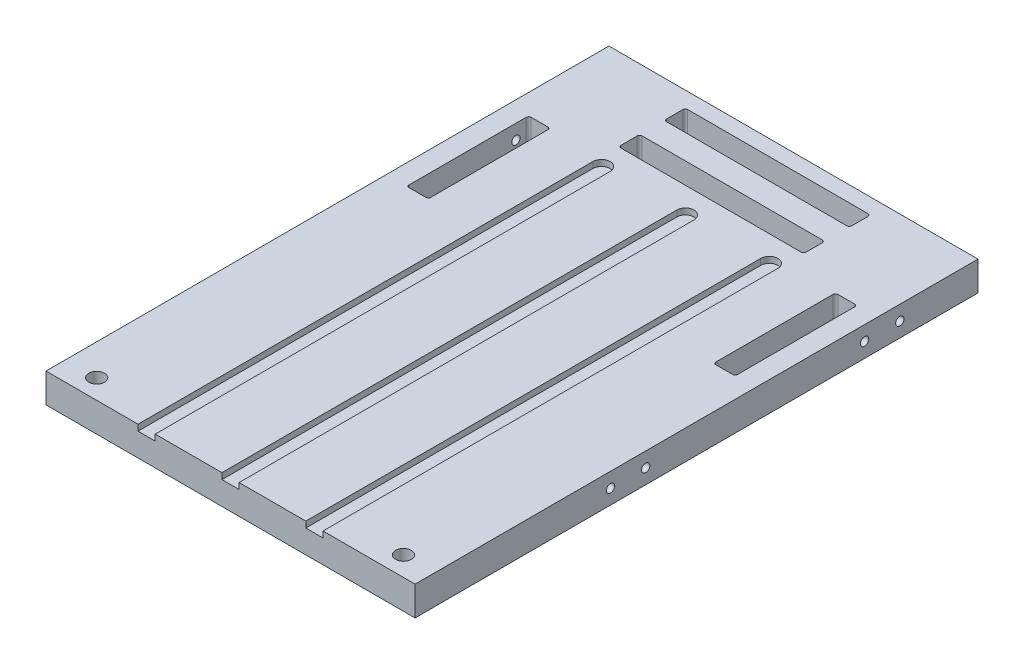
from build123d import *

# Parameters (mm, degrees)
SKETCH1_W                      = 119.888
SKETCH1_H                      = 182.88
BOSS_EXTRUDE1_DEPTH            = 9.525
F_1_4_20_TAPPED_HOLE1_D        = 5.1054
CUT_EXTRUDE1_DEPTH             = 1.9685
CUT_EXTRUDE2_DEPTH             = 1.9685
F_6_32_TAPPED_HOLE1_AT_2_COUNT = 2
F_6_32_TAPPED_HOLE1_AT_2_PITCH = 93.98
F_6_32_TAPPED_HOLE1_AT_3_COUNT = 2
F_6_32_TAPPED_HOLE1_AT_3_PITCH = 82.55
F_6_32_TAPPED_HOLE1_AT_4_COUNT = 2
F_6_32_TAPPED_HOLE1_AT_4_PITCH = 11.43


with BuildPart() as part:
    # Sketch1 → Boss-Extrude1 (new body)
    with BuildSketch(Plane(origin=(0, 0, 0), x_dir=(1, 0, 0), z_dir=(0, 1, 0))):
        Rectangle(SKETCH1_W, SKETCH1_H)
        with BuildLine():
            Line((-29.26715, 79.502), (29.26715, 79.502))
            ThreePointArc((29.26715, 79.502), (29.828416008, 79.734483992), (30.0609, 80.29575))
            Line((30.0609, 80.29575), (30.0609, 85.56625))
            ThreePointArc((30.0609, 85.56625), (29.828416008, 86.127516008), (29.26715, 86.36))
            Line((29.26715, 86.36), (-29.26715, 86.36))
            ThreePointArc((-29.26715, 86.36), (-29.828416008, 86.127516008), (-30.0609, 85.56625))
            Line((-30.0609, 85.56625), (-30.0609, 80.29575))
            ThreePointArc((-30.0609, 80.29575), (-29.828416008, 79.734483992), (-29.26715, 79.502))
        make_face(mode=Mode.SUBTRACT)
        with BuildLine():
            Line((-29.26715, 64.6811), (29.26715, 64.6811))
            ThreePointArc((29.26715, 64.6811), (29.828416008, 64.913583992), (30.0609, 65.47485))
            Line((30.0609, 65.47485), (30.0609, 70.74535))
            ThreePointArc((30.0609, 70.74535), (29.828416008, 71.306616008), (29.26715, 71.5391))
            Line((29.26715, 71.5391), (-29.26715, 71.5391))
            ThreePointArc((-29.26715, 71.5391), (-29.828416008, 71.306616008), (-30.0609, 70.74535))
            Line((-30.0609, 70.74535), (-30.0609, 65.47485))
            ThreePointArc((-30.0609, 65.47485), (-29.828416008, 64.913583992), (-29.26715, 64.6811))
        make_face(mode=Mode.SUBTRACT)
        with BuildLine():
            Line((-52.54625, 19.1262), (-47.11065, 19.1262))
            ThreePointArc((-47.11065, 19.1262), (-46.549383992, 19.358683992), (-46.3169, 19.91995))
            Line((-46.3169, 19.91995), (-46.3169, 57.95645))
            ThreePointArc((-46.3169, 57.95645), (-46.549383992, 58.517716008), (-47.11065, 58.7502))
            Line((-47.11065, 58.7502), (-52.54625, 58.7502))
            ThreePointArc((-52.54625, 58.7502), (-53.107516008, 58.517716008), (-53.34, 57.95645))
            Line((-53.34, 57.95645), (-53.34, 19.91995))
            ThreePointArc((-53.34, 19.91995), (-53.107516008, 19.358683992), (-52.54625, 19.1262))
        make_face(mode=Mode.SUBTRACT)
        with BuildLine():
            Line((46.3169, 19.91995), (46.3169, 57.95645))
            ThreePointArc((46.3169, 57.95645), (46.549383992, 58.517716008), (47.11065, 58.7502))
            Line((47.11065, 58.7502), (52.54625, 58.7502))
            ThreePointArc((52.54625, 58.7502), (53.107516008, 58.517716008), (53.34, 57.95645))
            Line((53.34, 57.95645), (53.34, 19.91995))
            ThreePointArc((53.34, 19.91995), (53.107516008, 19.358683992), (52.54625, 19.1262))
            Line((52.54625, 19.1262), (47.11065, 19.1262))
            ThreePointArc((47.11065, 19.1262), (46.549383992, 19.358683992), (46.3169, 19.91995))
        make_face(mode=Mode.SUBTRACT)
    extrude(amount=BOSS_EXTRUDE1_DEPTH)

    # 1/4-20 Tapped Hole1 (through all)
    with Locations(Plane(origin=(0, 9.525, 0), x_dir=(1, 0, 0), z_dir=(0, 1, 0))):
        with Locations((-49.82845, -85.09), (49.82845, -85.09)):
            Hole(F_1_4_20_TAPPED_HOLE1_D / 2)

    # Sketch4 → Cut-Extrude1 (cut)
    with BuildSketch(Plane(origin=(0, 9.525, 0), x_dir=(1, 0, 0), z_dir=(0, 1, 0))):
        with BuildLine():
            Line((-30.0482, -91.44), (-24.4602, -91.44))
            Line((-24.4602, -91.44), (-24.4602, 56.3372))
            ThreePointArc((-24.4602, 56.3372), (-27.2542, 59.1312), (-30.0482, 56.3372))
            Line((-30.0482, 56.3372), (-30.0482, -91.44))
        make_face()
        with BuildLine():
            Line((-2.794, 56.3372), (-2.794, -91.44))
            Line((-2.794, -91.44), (2.794, -91.44))
            Line((2.794, -91.44), (2.794, 56.3372))
            ThreePointArc((2.794, 56.3372), (0, 59.1312), (-2.794, 56.3372))
        make_face()
        with BuildLine():
            Line((30.0482, 56.3372), (30.0482, -91.44))
            Line((30.0482, -91.44), (24.4602, -91.44))
            Line((24.4602, -91.44), (24.4602, 56.3372))
            ThreePointArc((24.4602, 56.3372), (27.2542, 59.1312), (30.0482, 56.3372))
        make_face()
    extrude(amount=-CUT_EXTRUDE1_DEPTH, mode=Mode.SUBTRACT)

    # Sketch5 → Cut-Extrude2 (cut)
    with BuildSketch(Plane.XZ):
        with BuildLine():
            Line((-40.005, -73.10755), (40.005, -73.10755))
            ThreePointArc((40.005, -73.10755), (42.418, -75.52055), (40.005, -77.93355))
            Line((40.005, -77.93355), (-40.005, -77.93355))
            ThreePointArc((-40.005, -77.93355), (-42.418, -75.52055), (-40.005, -73.10755))
        make_face()
        with BuildLine():
            Line((-40.005, -58.28665), (40.005, -58.28665))
            ThreePointArc((40.005, -58.28665), (42.418, -60.69965), (40.005, -63.11265))
            Line((40.005, -63.11265), (-40.005, -63.11265))
            ThreePointArc((-40.005, -63.11265), (-42.418, -60.69965), (-40.005, -58.28665))
        make_face()
    extrude(amount=-CUT_EXTRUDE2_DEPTH, mode=Mode.SUBTRACT)

    # Sketch7 → #6-32 Tapped Hole1 (revolve, cut)
    with BuildSketch(Plane(origin=(-59.944, 4.7625, 27.94), x_dir=(0, 0, 1), z_dir=(0, 1, 0))):
        Polygon((0, 0), (0, 13.51269403), (1.35255, 12.7), (1.35255, 0), align=None)
    f_6_32_tapped_hole1 = revolve(axis=Axis((-66.294, 4.7625, 27.94), (1, 0, 0)), mode=Mode.SUBTRACT)

    # #6-32 Tapped Hole1 at 2: #6-32 Tapped Hole1 ×2
    with Locations(*[(0, 0, -i * F_6_32_TAPPED_HOLE1_AT_2_PITCH) for i in range(1, F_6_32_TAPPED_HOLE1_AT_2_COUNT)]):
        add(f_6_32_tapped_hole1, mode=Mode.SUBTRACT)

    # #6-32 Tapped Hole1 at 3: #6-32 Tapped Hole1 ×2
    with Locations(*[(0, 0, -i * F_6_32_TAPPED_HOLE1_AT_3_PITCH) for i in range(1, F_6_32_TAPPED_HOLE1_AT_3_COUNT)]):
        add(f_6_32_tapped_hole1, mode=Mode.SUBTRACT)

    # #6-32 Tapped Hole1 at 4: #6-32 Tapped Hole1 ×2
    with Locations(*[(0, 0, -i * F_6_32_TAPPED_HOLE1_AT_4_PITCH) for i in range(1, F_6_32_TAPPED_HOLE1_AT_4_COUNT)]):
        add(f_6_32_tapped_hole1, mode=Mode.SUBTRACT)

    # Mirror1: #6-32 Tapped Hole1 across plane
    add(f_6_32_tapped_hole1.mirror(Plane(origin=(0, 0, 0), x_dir=(0, 0, 1), z_dir=(1, 0, 0))), mode=Mode.SUBTRACT)

    # Mirror1 copy 1 sketch → Mirror1 copy 1 (revolve, cut)
    with BuildSketch(Plane(origin=(59.944, 4.7625, -66.04), x_dir=(0, 0, 1), z_dir=(0, 1, 0))):
        Polygon((0, 0), (0, -13.51269403), (1.35255, -12.7), (1.35255, 0), align=None)
    revolve(axis=Axis((66.294, 4.7625, -66.04), (1, 0, 0)), mode=Mode.SUBTRACT)

    # Mirror1 copy 2 sketch → Mirror1 copy 2 (revolve, cut)
    with BuildSketch(Plane(origin=(59.944, 4.7625, -54.61), x_dir=(0, 0, 1), z_dir=(0, 1, 0))):
        Polygon((0, 0), (0, -13.51269403), (1.35255, -12.7), (1.35255, 0), align=None)
    revolve(axis=Axis((66.294, 4.7625, -54.61), (1, 0, 0)), mode=Mode.SUBTRACT)

    # Mirror1 copy 3 sketch → Mirror1 copy 3 (revolve, cut)
    with BuildSketch(Plane(origin=(59.944, 4.7625, 16.51), x_dir=(0, 0, 1), z_dir=(0, 1, 0))):
        Polygon((0, 0), (0, -13.51269403), (1.35255, -12.7), (1.35255, 0), align=None)
    revolve(axis=Axis((66.294, 4.7625, 16.51), (1, 0, 0)), mode=Mode.SUBTRACT)


solid = part.part
